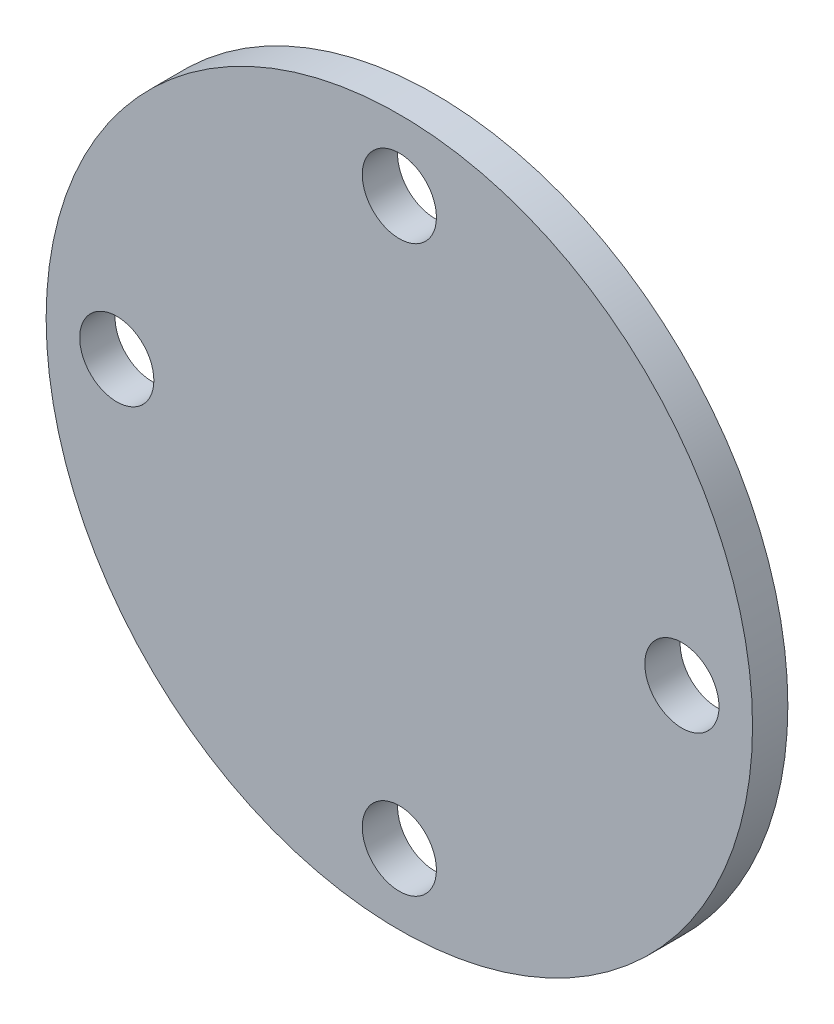
from build123d import *

# Parameters (mm, degrees)
SKETCH_1_R          = 10
EXTRUDE_1_DEPTH     = 1
SKETCH_2_R          = 1.05
CUT_EXTRUDE_1_DEPTH = 15.177446879


with BuildPart() as part:
    # 草图1 → 凸台-拉伸1 (new body)
    with BuildSketch(Plane.XY):
        Circle(SKETCH_1_R)
    extrude(amount=EXTRUDE_1_DEPTH)

    # 草图2 → 切除-拉伸1 (cut, through all)
    with BuildSketch(Plane.XY.offset(1)):
        with Locations((0, 8)):
            Circle(SKETCH_2_R)
        with Locations((8, 0)):
            Circle(SKETCH_2_R)
        with Locations((0, -8)):
            Circle(SKETCH_2_R)
        with Locations((-8, 0)):
            Circle(SKETCH_2_R)
    extrude(amount=-CUT_EXTRUDE_1_DEPTH, mode=Mode.SUBTRACT)


solid = part.part
